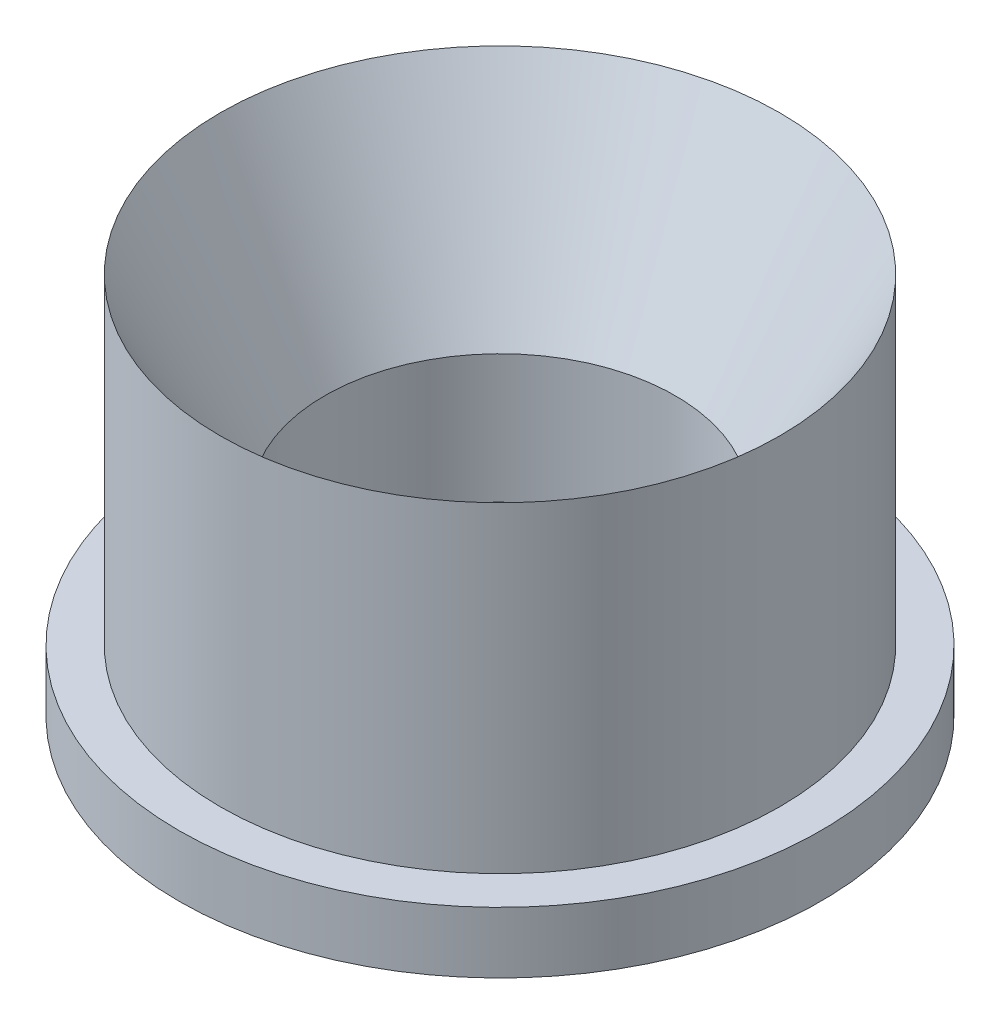
from build123d import *


with BuildPart() as part:
    # Sketch2 → Revolve1 (revolve)
    with BuildSketch(Plane(origin=(0, 0, 0), x_dir=(0, 1, 0), z_dir=(0, 0, 1)), mode=Mode.PRIVATE) as revolve1_sk:
        Polygon((0, 43.554), (0, 29.1925), (0, 27.2875), (20, 27.2875), (20, 43.554), align=None)
        Polygon((0, 49.972526435), (-9.525, 49.972526435), (-9.525, 29.1925), (0, 29.1925), (0, 43.554), align=None)
        Polygon((20, 27.2875), (50, 43.554), (20, 43.554), align=None)
    revolve(revolve1_sk.sketch.rotate(Axis((0, 52.97625, 0), (0, -1, 0)), 270), axis=Axis((0, 52.97625, 0), (0, -1, 0)))


solid = part.part
